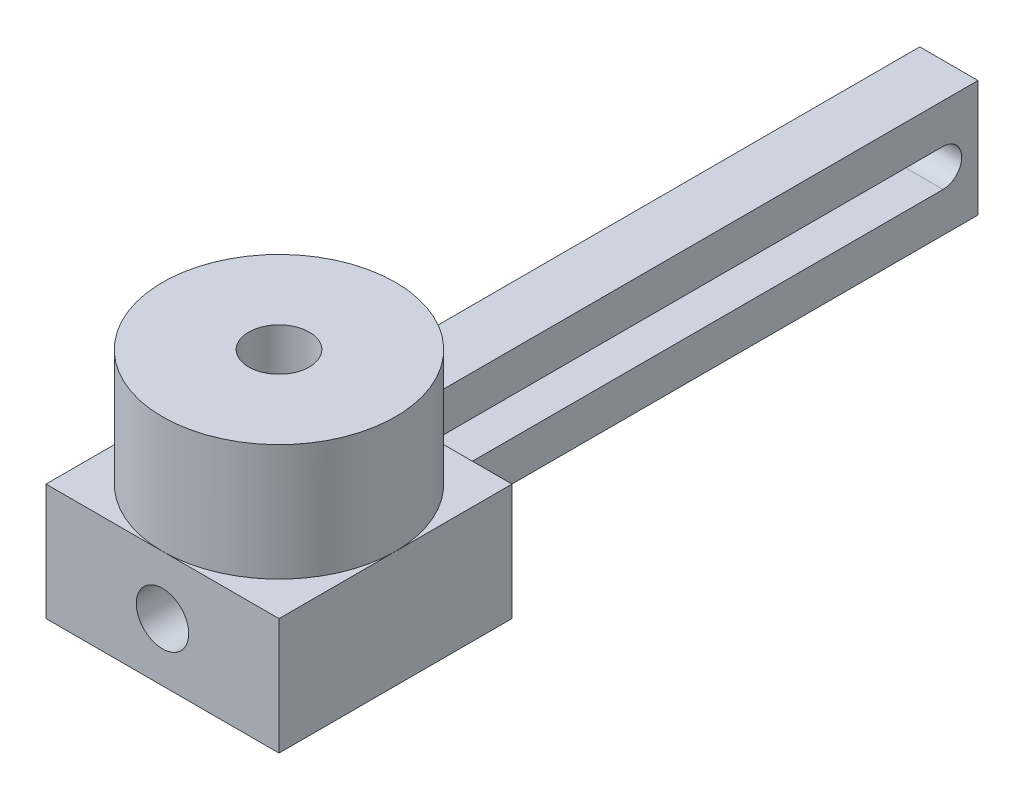
from build123d import *

# Parameters (mm, degrees)
SKETCH_3_W          = 10
SKETCH_3_H          = 60
EXTRUDE_3_DEPTH     = 10
SKETCH_4_R          = 10
SKETCH_4_R_2        = 2.6
EXTRUDE_4_DEPTH     = 20
SKETCH_6_W          = 6
SKETCH_6_H          = 50
CUT_EXTRUDE_2_DEPTH = 43.426406871
CUT_EXTRUDE_3_DEPTH = 48.16990566
SKETCH_16_W         = 20
SKETCH_16_H         = 10
EXTRUDE_5_DEPTH     = 20
SKETCH_5_R          = 2.6
CUT_EXTRUDE_1_DEPTH = 46.82575695
SKETCH_18_R         = 2.25
CUT_EXTRUDE_4_DEPTH = 10


with BuildPart() as part:
    # 草图3 → 凸台-拉伸3 (new body)
    with BuildSketch(Plane(origin=(0, 0, 0), x_dir=(1, 0, 0), z_dir=(0, 1, 0))):
        Rectangle(SKETCH_3_W, SKETCH_3_H)
    extrude(amount=EXTRUDE_3_DEPTH)

    # 草图4 → 凸台-拉伸4 (add)
    with BuildSketch(Plane(origin=(0, 0, 0), x_dir=(1, 0, 0), z_dir=(0, 1, 0))):
        with Locations(Location((0, -30, 0), (0, 0, 60))):
            Circle(SKETCH_4_R)
        with Locations(Location((0, -30, 0), (0, 0, 180))):
            Circle(SKETCH_4_R_2, mode=Mode.SUBTRACT)
    extrude(amount=EXTRUDE_4_DEPTH)

    # 草图6 → 切除-拉伸2 (cut, through all)
    with BuildSketch(Plane(origin=(0, 10, 0), x_dir=(1, 0, 0), z_dir=(0, 1, 0))):
        with Locations((3, 5)):
            Rectangle(SKETCH_6_W, SKETCH_6_H)
    extrude(amount=-CUT_EXTRUDE_2_DEPTH, mode=Mode.SUBTRACT)

    # 草图7 → 切除-拉伸3 (cut, through all)
    with BuildSketch(Plane.ZY.offset(5)):
        with BuildLine():
            Line((-27, 6.6), (16, 6.6))
            ThreePointArc((16, 6.6), (17.6, 5), (16, 3.4))
            Line((16, 3.4), (-27, 3.4))
            ThreePointArc((-27, 3.4), (-28.6, 5), (-27, 6.6))
        make_face()
    extrude(amount=-CUT_EXTRUDE_3_DEPTH, mode=Mode.SUBTRACT)

    # 草图16 → 凸台-拉伸5 (add)
    with BuildSketch(Plane.XY.offset(20)):
        with Locations((0, 5)):
            Rectangle(SKETCH_16_W, SKETCH_16_H)
    extrude(amount=EXTRUDE_5_DEPTH)

    # 草图5 → 切除-拉伸1 (cut, through all)
    with BuildSketch(Plane.XZ):
        with Locations(Location((0, 30, 0), (0, 0, 270))):
            Circle(SKETCH_5_R)
    extrude(amount=-CUT_EXTRUDE_1_DEPTH, mode=Mode.SUBTRACT)

    # 草图18 → 切除-拉伸4 (cut)
    with BuildSketch(Plane.XY.offset(40)):
        with Locations((0, 5)):
            Circle(SKETCH_18_R)
    extrude(amount=-CUT_EXTRUDE_4_DEPTH, mode=Mode.SUBTRACT)


solid = part.part
